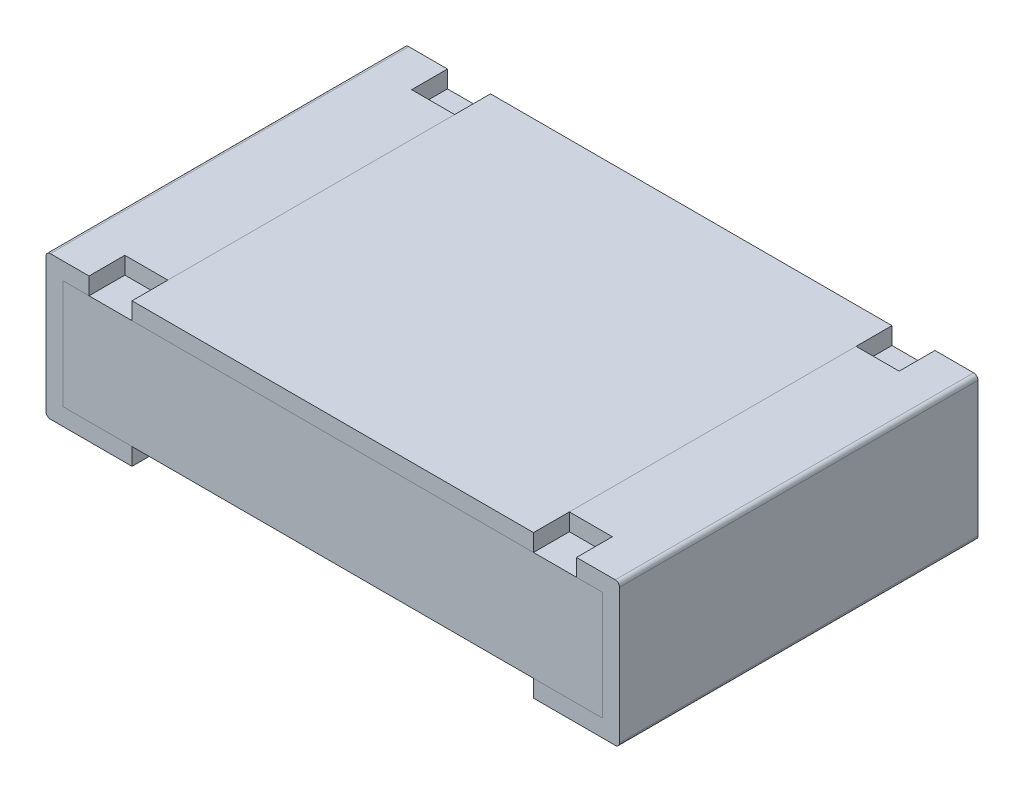
from build123d import *

# Parameters (mm, degrees)
BOSS_EXTRUDE1_DEPTH        = 0.625
BOSS_EXTRUDE1_DEPTH_BACK   = 0.625
BOSS_EXTRUDE1_2_DEPTH      = 0.625
BOSS_EXTRUDE1_2_DEPTH_BACK = 0.625
SKETCH3_W                  = 1.7
SKETCH3_H                  = 0.125
CUT_EXTRUDE1_DEPTH         = 0.06
FILLET1_R                  = 0.015
FILLET2_R                  = 0.015
SKETCH4_W                  = 1.88
SKETCH4_H                  = 0.38
BOSS_EXTRUDE2_DEPTH        = 1.25
SKETCH5_W                  = 1.4
SKETCH5_H                  = 1.25
BOSS_EXTRUDE3_DEPTH        = 0.06


with BuildPart() as part:
    # Sketch2 → Boss-Extrude1 (new, two sides: drawn at the far end of the back side and taken through both)
    with BuildSketch(Plane.XY.offset(-BOSS_EXTRUDE1_DEPTH_BACK)):
        Polygon((-0.7, 0), (-1, 0), (-1, 0.5), (-0.7, 0.5), (-0.7, 0.44), (-0.94, 0.44), (-0.94, 0.06), (-0.7, 0.06), align=None)
    extrude(amount=BOSS_EXTRUDE1_DEPTH + BOSS_EXTRUDE1_DEPTH_BACK)


with BuildPart() as body_2:
    # Sketch2 → Boss-Extrude1 2 (new, two sides: drawn at the far end of the back side and taken through both)
    with BuildSketch(Plane.XY.offset(-BOSS_EXTRUDE1_2_DEPTH_BACK)):
        Polygon((0.7, 0.06), (0.7, 0), (1, 0), (1, 0.5), (0.7, 0.5), (0.7, 0.44), (0.94, 0.44), (0.94, 0.06), align=None)
    extrude(amount=BOSS_EXTRUDE1_2_DEPTH + BOSS_EXTRUDE1_2_DEPTH_BACK)


with BuildPart() as cut_extrude1_tool:
    # Sketch3 → Cut-Extrude1 (new body)
    with BuildSketch(Plane(origin=(0, 0.5, 0), x_dir=(1, 0, 0), z_dir=(0, 1, 0))):
        with Locations((0, 0.5625)):
            Rectangle(SKETCH3_W, SKETCH3_H)
        with Locations((0, -0.5625)):
            Rectangle(SKETCH3_W, SKETCH3_H)
    extrude(amount=-CUT_EXTRUDE1_DEPTH)


with BuildPart() as part_1:
    add(part.part)

    # Cut-Extrude1: cut by cut_extrude1_tool
    add(cut_extrude1_tool.part, mode=Mode.SUBTRACT)

    # Fillet1
    fillet1_edges = [part_1.edges().sort_by_distance(p)[0] for p in [
        (-1, 0, 0),
        (-1, 0.5, 0),
    ]]
    fillet(fillet1_edges, radius=FILLET1_R)


with BuildPart() as body_2_1:
    add(body_2.part)

    # Cut-Extrude1: cut by cut_extrude1_tool
    add(cut_extrude1_tool.part, mode=Mode.SUBTRACT)

    # Fillet2
    fillet2_edges = [body_2_1.edges().sort_by_distance(p)[0] for p in [
        (1, 0, 0),
        (1, 0.5, 0),
    ]]
    fillet(fillet2_edges, radius=FILLET2_R)


with BuildPart() as body_3:
    # Sketch4 → Boss-Extrude2 (new body)
    with BuildSketch(Plane.XY.offset(0.625)):
        with Locations((0, 0.25)):
            Rectangle(SKETCH4_W, SKETCH4_H)
    extrude(amount=-BOSS_EXTRUDE2_DEPTH)


with BuildPart() as body_4:
    # Sketch5 → Boss-Extrude3 (new body)
    with BuildSketch(Plane(origin=(0, 0.5, 0), x_dir=(1, 0, 0), z_dir=(0, 1, 0))):
        Rectangle(SKETCH5_W, SKETCH5_H)
    extrude(amount=-BOSS_EXTRUDE3_DEPTH)


solid = Compound([part_1.part, body_2_1.part, body_3.part, body_4.part])
